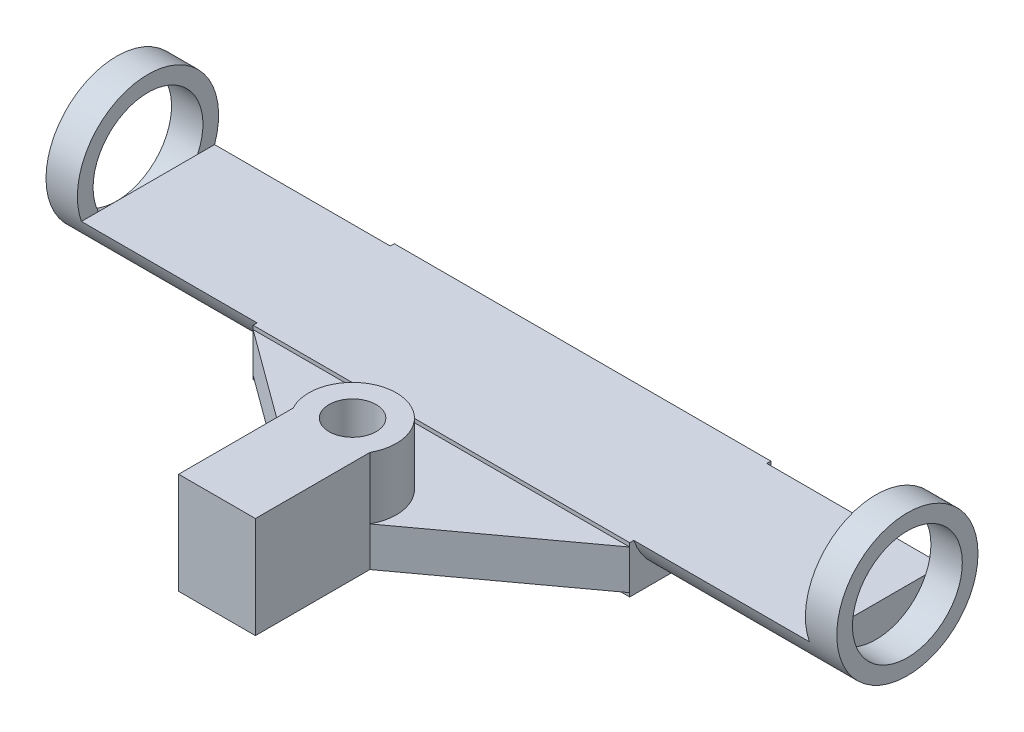
from build123d import *

# Parameters (mm, degrees)
SKETCH1_W           = 160
SKETCH1_H           = 28.575
BOSS_EXTRUDE1_DEPTH = 28.575
SKETCH3_W           = 147.3
SKETCH3_H           = 28.575
CUT_EXTRUDE3_DEPTH  = 19.05
SKETCH4_W           = 76.2
SKETCH4_H           = 8
BOSS_EXTRUDE2_DEPTH = 45.4
CUT_EXTRUDE8_DEPTH  = 124.871382326
SKETCH9_R           = 4.7625
BOSS_EXTRUDE4_DEPTH = 12.525
SKETCH10_R          = 4.7625
CUT_EXTRUDE10_DEPTH = 124.871382326
CUT_EXTRUDE11_START = -41.9
SKETCH2_OUTSIDE_W   = 111.689
SKETCH2_OUTSIDE_H   = 66.289
SKETCH2_OUTSIDE_R   = 14.2875
CUT_EXTRUDE11_DEPTH = 41.9
CUT_EXTRUDE13_START = -41.9
SKETCH13_OUTSIDE_W  = 111.689
SKETCH13_OUTSIDE_H  = 66.289
SKETCH13_OUTSIDE_R  = 14.2875
CUT_EXTRUDE13_DEPTH = 41.9
SKETCH14_R          = 11.1125
CUT_EXTRUDE14_DEPTH = 6.35
CUT_EXTRUDE15_START = -6.35
SKETCH15_R          = 11.1125
CUT_EXTRUDE15_DEPTH = 6.35


with BuildPart() as part:
    # Sketch1 → Boss-Extrude1 (new body)
    with BuildSketch(Plane(origin=(0, 0, 0), x_dir=(1, 0, 0), z_dir=(0, 1, 0))):
        with Locations((-20.782379652, -9.554800327)):
            Rectangle(SKETCH1_W, SKETCH1_H)
    extrude(amount=BOSS_EXTRUDE1_DEPTH)

    # Sketch3 → Cut-Extrude3 (cut)
    with BuildSketch(Plane(origin=(0, 28.575, 0), x_dir=(1, 0, 0), z_dir=(0, 1, 0))):
        with Locations((-20.782379652, -9.554800327)):
            Rectangle(SKETCH3_W, SKETCH3_H)
    extrude(amount=-CUT_EXTRUDE3_DEPTH, mode=Mode.SUBTRACT)

    # Sketch4 → Boss-Extrude2 (add)
    with BuildSketch(Plane.XY.offset(23.842300327)):
        with Locations((-20.782379652, 4.7625)):
            Rectangle(SKETCH4_W, SKETCH4_H)
    extrude(amount=BOSS_EXTRUDE2_DEPTH)

    # Sketch5 → Cut-Extrude8 (cut, through all)
    with BuildSketch(Plane(origin=(0, 8.7625, 0), x_dir=(1, 0, 0), z_dir=(0, 1, 0))):
        Polygon((-13.013921372, -46.075787503), (-13.013921372, -69.242300327), (17.317620348, -69.242300327), (17.317620348, -23.842300327), align=None)
        Polygon((-28.550837933, -69.242300327), (-28.550837933, -46.075787503), (-58.882379652, -23.842300327), (-58.882379652, -69.242300327), align=None)
    extrude(amount=-CUT_EXTRUDE8_DEPTH, mode=Mode.SUBTRACT)

    # Sketch9 → Boss-Extrude4 (add)
    with BuildSketch(Plane(origin=(0, 8.7625, 0), x_dir=(1, 0, 0), z_dir=(0, 1, 0))):
        with BuildLine():
            Line((-28.550837933, -46.075787503), (-28.550837933, -69.242300327))
            Line((-28.550837933, -69.242300327), (-13.013921372, -69.242300327))
            Line((-13.013921372, -69.242300327), (-13.013921372, -46.075787503))
            ThreePointArc((-13.013921372, -46.075787503), (-20.782379652, -32.954800327), (-28.550837933, -46.075787503))
        make_face()
        with Locations(Location((-20.782379652, -41.815004419, 0), (0, 0, 180))):
            Circle(SKETCH9_R, mode=Mode.SUBTRACT)
    extrude(amount=BOSS_EXTRUDE4_DEPTH)

    # Sketch10 → Cut-Extrude10 (cut, through all)
    with BuildSketch(Plane(origin=(0, 8.7625, 0), x_dir=(1, 0, 0), z_dir=(0, 1, 0))):
        with Locations(Location((-20.782379652, -41.815004419, 0), (0, 0, 180))):
            Circle(SKETCH10_R)
    extrude(amount=-CUT_EXTRUDE10_DEPTH, mode=Mode.SUBTRACT)

    # Sketch2 outside → Cut-Extrude11 (cut)
    with BuildSketch(Plane(origin=(59.217620348, 0, 0), x_dir=(0, 0, -1), z_dir=(1, 0, 0)).offset(CUT_EXTRUDE11_START)):
        with Locations((-32.2545, 14.2875)):
            Rectangle(SKETCH2_OUTSIDE_W, SKETCH2_OUTSIDE_H)
        with Locations((-9.554800327, 14.2875)):
            Circle(SKETCH2_OUTSIDE_R, mode=Mode.SUBTRACT)
    extrude(amount=CUT_EXTRUDE11_DEPTH, mode=Mode.SUBTRACT)

    # Sketch13 outside → Cut-Extrude13 (cut)
    with BuildSketch(Plane.ZY.offset(100.782379652).offset(CUT_EXTRUDE13_START)):
        with Locations((32.2545, 14.2875)):
            Rectangle(SKETCH13_OUTSIDE_W, SKETCH13_OUTSIDE_H)
        with Locations(Location((9.554800327, 14.2875, 0), (0, 0, 180))):
            Circle(SKETCH13_OUTSIDE_R, mode=Mode.SUBTRACT)
    extrude(amount=CUT_EXTRUDE13_DEPTH, mode=Mode.SUBTRACT)

    # Sketch14 → Cut-Extrude14 (cut)
    with BuildSketch(Plane(origin=(59.217620348, 0, 0), x_dir=(0, 0, -1), z_dir=(1, 0, 0))):
        with Locations((-9.554800327, 14.2875)):
            Circle(SKETCH14_R)
    extrude(amount=-CUT_EXTRUDE14_DEPTH, mode=Mode.SUBTRACT)

    # Sketch15 → Cut-Extrude15 (cut)
    with BuildSketch(Plane.ZY.offset(100.782379652).offset(CUT_EXTRUDE15_START)):
        with Locations(Location((9.554800327, 14.2875, 0), (0, 0, 180))):
            Circle(SKETCH15_R)
    extrude(amount=CUT_EXTRUDE15_DEPTH, mode=Mode.SUBTRACT)


solid = part.part
